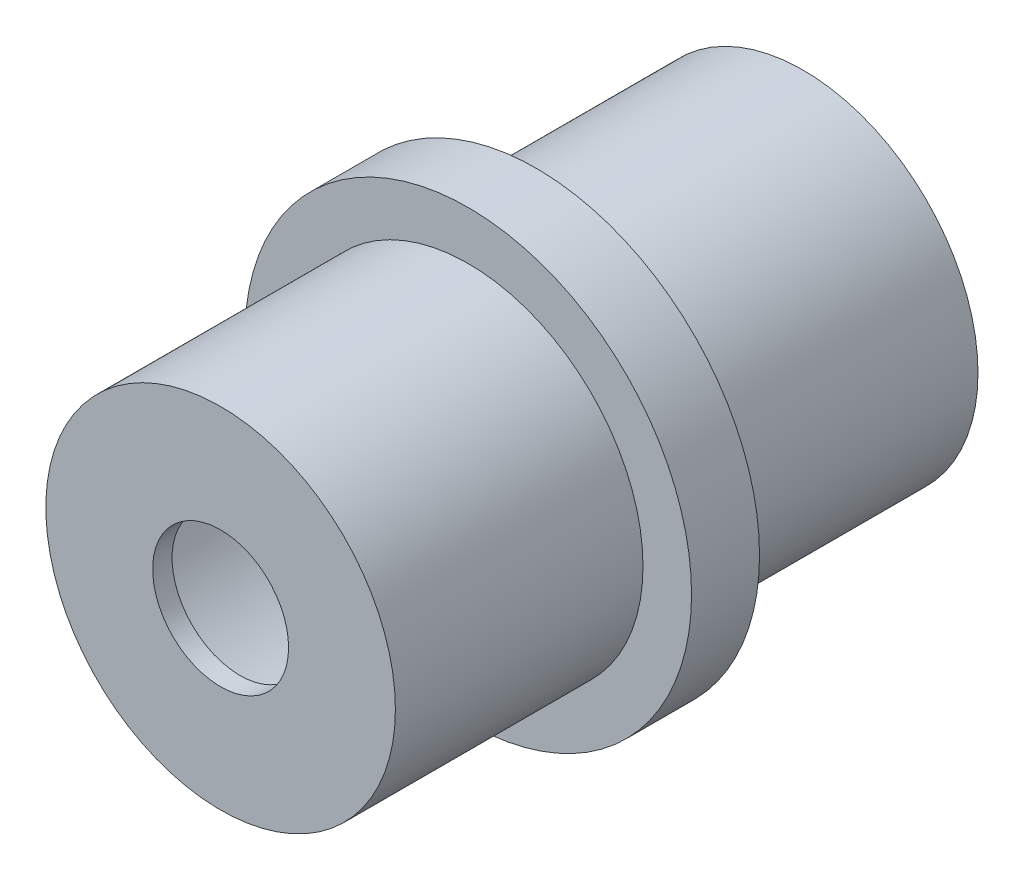
from build123d import *

# Parameters (mm, degrees)
CUT_EXTRUDE1_DEPTH = 2
CUT_EXTRUDE2_DEPTH = 1


with BuildPart() as part:
    # Sketch1 → Revolve1 (revolve)
    with BuildSketch(Plane(origin=(0, 0, 0), x_dir=(0, 0, -1), z_dir=(1, 0, 0))):
        Polygon((-60, 18), (-60, 7), (-58, 7), (-58, 17), (-2, 17), (-2, 13), (0, 13), (0, 18), (-27.5, 18), (-27.5, 23), (-34.5, 23), (-34.5, 18), align=None)
    revolve(axis=Axis((0, 0, 1072.381477522), (0, 0, -1)))

    # Sketch3 → Cut-Extrude1 (cut, symmetric)
    with BuildSketch(Plane.XY.offset(31)):
        with BuildLine():
            ThreePointArc((-6.498382723, 17.854159795), (0, -19), (6.498382723, 17.854159795))
            Line((6.498382723, 17.854159795), (7.524443153, 20.673237657))
            ThreePointArc((7.524443153, 20.673237657), (0, 22), (-7.524443153, 20.673237657))
            Line((-7.524443153, 20.673237657), (-6.498382723, 17.854159795))
        make_face()
        with BuildLine():
            add(Edge.make_bspline(
                [(-1, 19.972475891), (-1.837517439, 19.972475891), (-3.400702548, 17.606617047), (-4.505243001, 16.51810785)],
                knots=[0, 0, 0, 0, 1, 1, 1, 1], degree=3))
            Line((-1, 19.972475891), (1, 19.972475891))
            add(Edge.make_bspline(
                [(1, 19.972475891), (1.837517439, 19.972475891), (3.400702548, 17.606617047), (4.505243001, 16.51810785)],
                knots=[0, 0, 0, 0, 1, 1, 1, 1], degree=3))
            Line((4.505243001, 16.51810785), (4.683957663, 16.341987046))
            ThreePointArc((4.683957663, 16.341987046), (13.576215973, 10.231635249), (17, 0))
            ThreePointArc((17, 0), (-10.231635249, -13.576215973), (-4.683957663, 16.341987046))
            Line((-4.683957663, 16.341987046), (-4.505243001, 16.51810785))
        make_face(mode=Mode.SUBTRACT)
    extrude(amount=CUT_EXTRUDE1_DEPTH, both=True, mode=Mode.SUBTRACT)

    # Sketch3<5> → Cut-Extrude2 (cut, symmetric)
    with BuildSketch(Plane.XY.offset(31)):
        with BuildLine():
            Line((1, 19.972475891), (-1, 19.972475891))
            add(Edge.make_bspline(
                [(-1, 19.972475891), (-1.837517439, 19.972475891), (-3.400702548, 17.606617047), (-4.505243001, 16.51810785)],
                knots=[0, 0, 0, 0, 1, 1, 1, 1], degree=3))
            Line((-4.505243001, 16.51810785), (-4.683957663, 16.341987046))
            ThreePointArc((-4.683957663, 16.341987046), (0, -17), (4.683957663, 16.341987046))
            Line((4.683957663, 16.341987046), (4.505243001, 16.51810785))
            add(Edge.make_bspline(
                [(1, 19.972475891), (1.837517439, 19.972475891), (3.400702548, 17.606617047), (4.505243001, 16.51810785)],
                knots=[0, 0, 0, 0, 1, 1, 1, 1], degree=3))
        make_face()
        with BuildLine():
            Line((7.524443153, 20.673237657), (6.498382723, 17.854159795))
            ThreePointArc((6.498382723, 17.854159795), (0, -19), (-6.498382723, 17.854159795))
            Line((-6.498382723, 17.854159795), (-7.524443153, 20.673237657))
            ThreePointArc((-7.524443153, 20.673237657), (0, -22), (7.524443153, 20.673237657))
        make_face()
    extrude(amount=CUT_EXTRUDE2_DEPTH, both=True, mode=Mode.SUBTRACT)


solid = part.part
